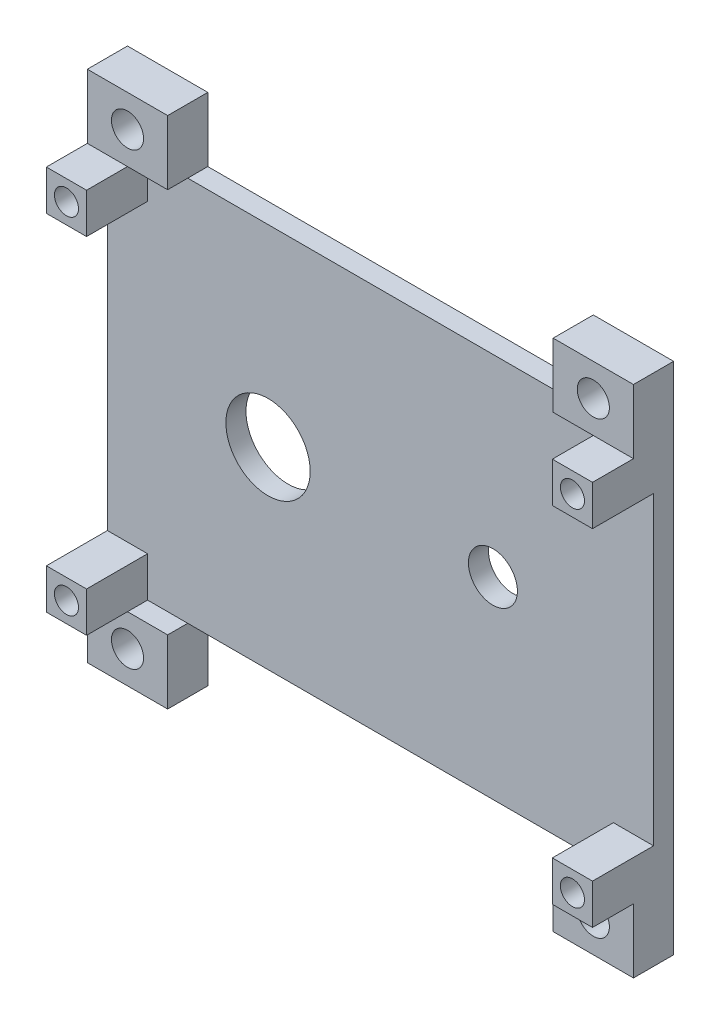
from build123d import *

# Parameters (mm, degrees)
SKICA1_W                     = 68
SKICA1_H                     = 48
SKICA1_R                     = 5.25
SKICA1_R_2                   = 3.05
P_IDAT_VYSUNUT_M1_DEPTH      = 2.5
SKICA2_W                     = 5
SKICA2_H                     = 5
P_IDAT_VYSUNUT_M2_DEPTH      = 7.6
SKICA3_R                     = 1.5
ODEBRAT_VYSUNUT_M1_DEPTH     = 10.1
SKICA8_R                     = 1.5
ODEBRAT_VYSUNUT_M2_DEPTH     = 10.1
SKICA9_R                     = 1.5
ODEBRAT_VYSUNUT_M3_DEPTH     = 10.1
SKICA10_R                    = 1.5
ODEBRAT_VYSUNUT_M4_DEPTH     = 10.1
P_IDAT_VYSUNUT_M3_DEPTH      = 8
P_IDAT_VYSUNUT_M3_DEPTH_BACK = 56
SKICA11_W                    = 10
SKICA11_H                    = 2.5
SKICA12_R                    = 2
ODEBRAT_VYSUNUT_M5_DEPTH     = 8
P_IDAT_START                 = 2.5
SKICA13_W                    = 10
SKICA13_H                    = 8
SKICA13_R                    = 2
P_IDAT_VYSUNUT_M4_DEPTH      = 2.5


with BuildPart() as part:
    # Skica1 → Přidat vysunutím1 (new body)
    with BuildSketch(Plane.XY):
        Rectangle(SKICA1_W, SKICA1_H)
        with Locations((-14, 0)):
            Circle(SKICA1_R, mode=Mode.SUBTRACT)
        with Locations((14, 0)):
            Circle(SKICA1_R_2, mode=Mode.SUBTRACT)
    extrude(amount=P_IDAT_VYSUNUT_M1_DEPTH)

    # Skica2 → Přidat vysunutím2 (add)
    with BuildSketch(Plane.XY.offset(2.5)):
        with Locations((-31.5, 21.5)):
            Rectangle(SKICA2_W, SKICA2_H)
        with Locations((31.5, 21.5)):
            Rectangle(SKICA2_W, SKICA2_H)
        with Locations((31.5, -21.5)):
            Rectangle(SKICA2_W, SKICA2_H)
        with Locations((-31.5, -21.5)):
            Rectangle(SKICA2_W, SKICA2_H)
    extrude(amount=P_IDAT_VYSUNUT_M2_DEPTH)

    # Skica3 → Odebrat vysunutím1 (cut)
    with BuildSketch(Plane.XY.offset(10.1)):
        with Locations((-31.5, 21.5)):
            Circle(SKICA3_R)
    extrude(amount=-ODEBRAT_VYSUNUT_M1_DEPTH, mode=Mode.SUBTRACT)

    # Skica8 → Odebrat vysunutím2 (cut)
    with BuildSketch(Plane.XY.offset(10.1)):
        with Locations((31.5, 21.5)):
            Circle(SKICA8_R)
    extrude(amount=-ODEBRAT_VYSUNUT_M2_DEPTH, mode=Mode.SUBTRACT)

    # Skica9 → Odebrat vysunutím3 (cut)
    with BuildSketch(Plane.XY.offset(10.1)):
        with Locations((31.5, -21.5)):
            Circle(SKICA9_R)
    extrude(amount=-ODEBRAT_VYSUNUT_M3_DEPTH, mode=Mode.SUBTRACT)

    # Skica10 → Odebrat vysunutím4 (cut)
    with BuildSketch(Plane.XY.offset(10.1)):
        with Locations((-31.5, -21.5)):
            Circle(SKICA10_R)
    extrude(amount=-ODEBRAT_VYSUNUT_M4_DEPTH, mode=Mode.SUBTRACT)

    # Skica11 → Přidat vysunutím3 (add, two sides: drawn at the far end of the back side and taken through both)
    with BuildSketch(Plane(origin=(0, 24, 0), x_dir=(1, 0, 0), z_dir=(0, 1, 0)).offset(-P_IDAT_VYSUNUT_M3_DEPTH_BACK)):
        with Locations((-29, -1.25)):
            Rectangle(SKICA11_W, SKICA11_H)
        with Locations((29, -1.25)):
            Rectangle(SKICA11_W, SKICA11_H)
    extrude(amount=P_IDAT_VYSUNUT_M3_DEPTH + P_IDAT_VYSUNUT_M3_DEPTH_BACK)

    # Skica12 → Odebrat vysunutím5 (cut)
    with BuildSketch(Plane.XY.offset(2.5)):
        with Locations((-29, 28)):
            Circle(SKICA12_R)
        with Locations((29, 28)):
            Circle(SKICA12_R)
        with Locations((29, -28)):
            Circle(SKICA12_R)
        with Locations((-29, -28)):
            Circle(SKICA12_R)
    extrude(amount=-ODEBRAT_VYSUNUT_M5_DEPTH, mode=Mode.SUBTRACT)

    # Skica13 → Přidat vysunutím4 (add)
    # profile 1 of 4: a face of its own
    with BuildSketch(Plane.XY.offset(2.5).offset(P_IDAT_START)):
        with Locations((-29, 28)):
            Rectangle(SKICA13_W, SKICA13_H)
        with Locations((-29, 28)):
            Circle(SKICA13_R, mode=Mode.SUBTRACT)
    # profile 2 of 4: a face of its own
    with BuildSketch(Plane.XY.offset(2.5).offset(P_IDAT_START)):
        with Locations((29, 28)):
            Rectangle(SKICA13_W, SKICA13_H)
        with Locations((29, 28)):
            Circle(SKICA13_R, mode=Mode.SUBTRACT)
    # profile 3 of 4: a face of its own
    with BuildSketch(Plane.XY.offset(2.5).offset(P_IDAT_START)):
        with Locations((29, -28)):
            Rectangle(SKICA13_W, SKICA13_H)
        with Locations((29, -28)):
            Circle(SKICA13_R, mode=Mode.SUBTRACT)
    # profile 4 of 4: a face of its own
    with BuildSketch(Plane.XY.offset(2.5).offset(P_IDAT_START)):
        with Locations((-29, -28)):
            Rectangle(SKICA13_W, SKICA13_H)
        with Locations((-29, -28)):
            Circle(SKICA13_R, mode=Mode.SUBTRACT)
    extrude(amount=-P_IDAT_VYSUNUT_M4_DEPTH)


solid = part.part
